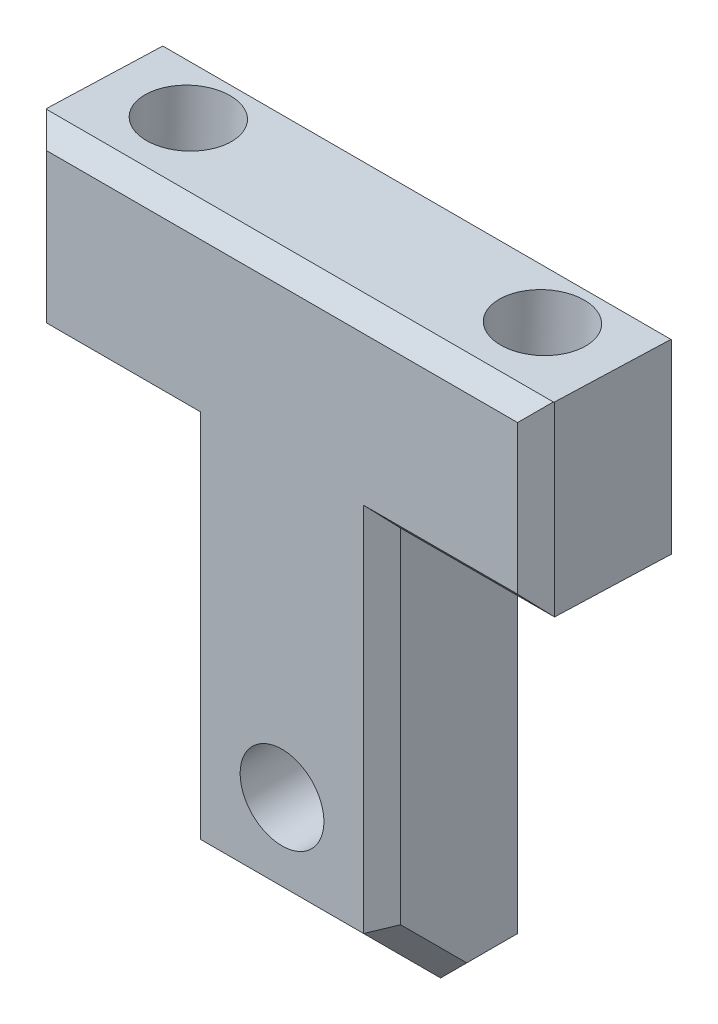
from build123d import *
from OCP.BRepFilletAPI import BRepFilletAPI_MakeChamfer

# Parameters (mm, degrees)
SKETCH1_W             = 8.255
SKETCH1_H             = 22.225
BOSS_EXTRUDE1_DEPTH   = 6.35
SKETCH2_W             = 6.35
SKETCH2_H             = 4.7625
BOSS_EXTRUDE2_DEPTH   = 6.35
BOSS_EXTRUDE3_START   = -8.255
SKETCH2_4_W           = 6.35
SKETCH2_4_H           = 4.7625
BOSS_EXTRUDE3_DEPTH   = 6.35
SKETCH4_W             = 20.955
SKETCH4_H             = 6.35
BOSS_EXTRUDE4_DEPTH   = 3.135241634
CUT_EXTRUDE3_DEPTH    = 32.199120981
CUT_EXTRUDE4_DEPTH    = 6.35
CUT_EXTRUDE5_START    = -20.955
CUT_EXTRUDE5_DEPTH    = 6.35
F_4_CLEARANCE_HOLE1_D = 3.4544
F_4_CLEARANCE_HOLE2_D = 3.4544
CHAMFER1_SIZE         = 3.175
CHAMFER2_SIZE         = 0.762
CHAMFER2_SIZE2        = 0.737097047
CHAMFER2_SIZE2_2      = 0.789610507


with BuildPart() as part:
    # Sketch1 → Boss-Extrude1 (new body)
    with BuildSketch(Plane.XY):
        with Locations((-57.516108776, -11.1125)):
            Rectangle(SKETCH1_W, SKETCH1_H)
    extrude(amount=BOSS_EXTRUDE1_DEPTH)

    # Sketch2 → Boss-Extrude2 (add)
    with BuildSketch(Plane.ZY.offset(61.643608776)):
        with Locations((3.175, -2.38125)):
            Rectangle(SKETCH2_W, SKETCH2_H)
    extrude(amount=BOSS_EXTRUDE2_DEPTH)

    # Sketch2<4> → Boss-Extrude3 (add)
    with BuildSketch(Plane.ZY.offset(61.643608776).offset(BOSS_EXTRUDE3_START)):
        with Locations((3.175, -2.38125)):
            Rectangle(SKETCH2_4_W, SKETCH2_4_H)
    extrude(amount=-BOSS_EXTRUDE3_DEPTH)

    # Sketch4 → Boss-Extrude4 (add)
    with BuildSketch(Plane(origin=(0, 0, 0), x_dir=(1, 0, 0), z_dir=(0, 1, 0))):
        with Locations((-57.516108776, -3.175)):
            Rectangle(SKETCH4_W, SKETCH4_H)
    extrude(amount=BOSS_EXTRUDE4_DEPTH)

    # Sketch5 → Cut-Extrude3 (cut, through all)
    with BuildSketch(Plane.ZY.offset(67.993608776)):
        Polygon((0, 2.916823594), (6.35, 3.135241634), (0, 3.135241634), align=None)
    extrude(amount=-CUT_EXTRUDE3_DEPTH, mode=Mode.SUBTRACT)

    # Sketch6 → Cut-Extrude4 (cut)
    with BuildSketch(Plane.ZY.offset(67.993608776)):
        Polygon((0, -4.7625), (6.35, -4.54408196), (6.35, -4.7625), align=None)
    extrude(amount=-CUT_EXTRUDE4_DEPTH, mode=Mode.SUBTRACT)

    # Sketch6<2> → Cut-Extrude5 (cut)
    with BuildSketch(Plane.ZY.offset(67.993608776).offset(CUT_EXTRUDE5_START)):
        Polygon((0, -4.7625), (6.35, -4.54408196), (6.35, -4.7625), align=None)
    extrude(amount=CUT_EXTRUDE5_DEPTH, mode=Mode.SUBTRACT)

    # #4 Clearance Hole1 (through all)
    with Locations(Plane(origin=(0, -4.75687204, 0.163619948), x_dir=(-1, 0, 0), z_dir=(0, -0.9994089633576719, 0.03437621212908539))):
        with Locations((50.213608776, -3.013160941), (64.818608776, -3.013160941)):
            Hole(F_4_CLEARANCE_HOLE1_D / 2)

    # #4 Clearance Hole2 (through all)
    with Locations(Plane(origin=(0, 0, 0), x_dir=(-1, 0, 0), z_dir=(0, 0, -1))):
        with Locations((57.516108776, -15.875)):
            Hole(F_4_CLEARANCE_HOLE2_D / 2)

    # Sketch16 → Hole1 (revolve, cut)
    with BuildSketch(Plane(origin=(-57.516108776, -15.875, 0), x_dir=(0, 1, 0), z_dir=(1, 0, 0))):
        Polygon((0, 0), (0, 3.429), (1.9431, 3.429), (2.0701, 0), align=None)
    revolve(axis=Axis((-57.516108776, -15.875, 110), (0, 0, -1)), mode=Mode.SUBTRACT)

    # Chamfer1
    chamfer1_edges = [part.edges().sort_by_distance(p)[0] for p in [
        (-57.516108776, -22.225, 6.35),
    ]]
    chamfer(chamfer1_edges, length=CHAMFER1_SIZE)

    # Chamfer2: one chamfer whose edges measure the first distance from different faces: ONE call of the kernel's chamfer builder (chamfer() names one face for all edges)
    chamfer2_edges_1 = [part.edges().sort_by_distance(p)[0] for p in [
        (-53.388608776, -11.79704098, 6.35),
        (-53.388608776, -22.225, 1.5875),
        (-53.388608776, -20.6375, 4.7625),
        (-61.643608776, -22.225, 1.5875),
        (-61.643608776, -20.6375, 4.7625),
        (-61.643608776, -13.49375, 0),
        (-61.643608776, -11.79704098, 6.35),
        (-47.038608776, -0.704420163, 6.35),
        (-47.038608776, -0.922838203, 0),
        (-67.993608776, -0.922838203, 0),
        (-53.388608776, -13.49375, 0),
        (-57.516108776, -22.225, 0),
        (-67.993608776, -0.704420163, 6.35),
    ]]
    chamfer2_edges_2 = [part.edges().sort_by_distance(p)[0] for p in [
        (-64.818608776, -4.7625, 0),
    ]]
    chamfer2_side_2 = [part.faces().sort_by_distance(p)[0] for p in [
        (-57.516108776, -6.446773357, 0),
    ]]
    chamfer2_edges_3 = [part.edges().sort_by_distance(p)[0] for p in [
        (-50.213608776, -4.7625, 0),
    ]]
    chamfer2_side_3 = [part.faces().sort_by_distance(p)[0] for p in [
        (-50.213608776, -4.759412015, 0.089776027),
    ]]
    chamfer2_edges_4 = [part.edges().sort_by_distance(p)[0] for p in [
        (-57.516108776, 3.135241634, 6.35),
    ]]
    chamfer2_side_4 = [part.faces().sort_by_distance(p)[0] for p in [
        (-57.516108776, -5.076499977, 6.35),
    ]]
    chamfer2_edges_5 = [part.edges().sort_by_distance(p)[0] for p in [
        (-57.516108776, 2.916823594, 0),
    ]]
    chamfer2_side_5 = [part.faces().sort_by_distance(p)[0] for p in [
        (-57.516108776, -6.446773357, 0),
    ]]
    chamfer2_edges_6 = [part.edges().sort_by_distance(p)[0] for p in [
        (-64.818608776, -4.54408196, 6.35),
    ]]
    chamfer2_side_6 = [part.faces().sort_by_distance(p)[0] for p in [
        (-57.516108776, -5.076499977, 6.35),
    ]]
    chamfer2_edges_7 = [part.edges().sort_by_distance(p)[0] for p in [
        (-50.213608776, -4.54408196, 6.35),
    ]]
    chamfer2_side_7 = [part.faces().sort_by_distance(p)[0] for p in [
        (-50.213608776, -4.759412015, 0.089776027),
    ]]
    chamfer2 = BRepFilletAPI_MakeChamfer(part.part.solid().wrapped)
    for e in chamfer2_edges_1:
        chamfer2.Add(CHAMFER2_SIZE, e.wrapped)
    for e in chamfer2_edges_2:
        chamfer2.Add(CHAMFER2_SIZE, CHAMFER2_SIZE2, e.wrapped, chamfer2_side_2[0].wrapped)  # the first distance lies on this face
    for e in chamfer2_edges_3:
        chamfer2.Add(CHAMFER2_SIZE, CHAMFER2_SIZE2, e.wrapped, chamfer2_side_3[0].wrapped)  # the first distance lies on this face
    for e in chamfer2_edges_4:
        chamfer2.Add(CHAMFER2_SIZE, CHAMFER2_SIZE2, e.wrapped, chamfer2_side_4[0].wrapped)  # the first distance lies on this face
    for e in chamfer2_edges_5:
        chamfer2.Add(CHAMFER2_SIZE, CHAMFER2_SIZE2_2, e.wrapped, chamfer2_side_5[0].wrapped)  # the first distance lies on this face
    for e in chamfer2_edges_6:
        chamfer2.Add(CHAMFER2_SIZE, CHAMFER2_SIZE2_2, e.wrapped, chamfer2_side_6[0].wrapped)  # the first distance lies on this face
    for e in chamfer2_edges_7:
        chamfer2.Add(CHAMFER2_SIZE, CHAMFER2_SIZE2_2, e.wrapped, chamfer2_side_7[0].wrapped)  # the first distance lies on this face
    add(Compound.cast(chamfer2.Shape()), mode=Mode.REPLACE)


solid = part.part
